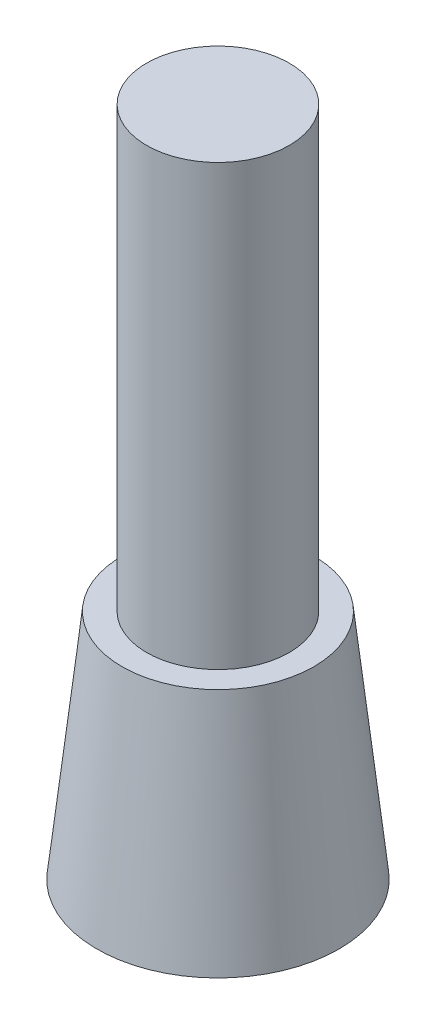
from build123d import *


with BuildPart() as part:
    # Sketch1 → Revolve1 (revolve)
    with BuildSketch(Plane.XY):
        Polygon((0, 22.9362), (0, 6.35), (1.5, 6.35), (1.5, 0), (4.1402, 0), (3.2766, 7.9248), (2.4384, 7.9248), (2.4384, 22.9362), align=None)
    revolve(axis=Axis((0, 0, 0), (0, 1, 0)))


solid = part.part
